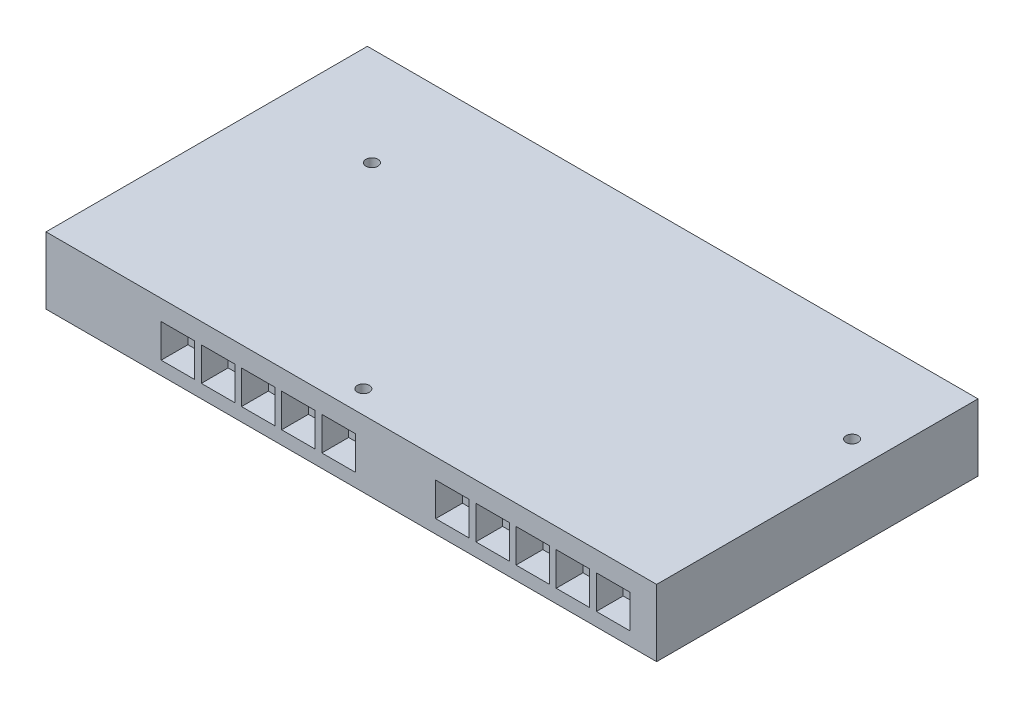
from build123d import *

# Parameters (mm, degrees)
SKETCH1_W                              = 228
SKETCH1_H                              = 25
BOSS_EXTRUDE1_DEPTH                    = 60
SKETCH3_W                              = 12.5
SKETCH3_H                              = 12.5
CUT_EXTRUDE2_DEPTH                     = 10
LPATTERN1_COUNT                        = 2
LPATTERN1_PITCH                        = 102.5
SKETCH7_R                              = 7.5
BOSS_EXTRUDE4_DEPTH                    = 3
BOSS_EXTRUDE4_DRAFT                    = 20
BOSS_EXTRUDE4_PROFILE_2_DEPTH          = 3
BOSS_EXTRUDE4_PROFILE_2_DRAFT          = 20
BOSS_EXTRUDE4_PROFILE_3_DEPTH          = 3
BOSS_EXTRUDE4_PROFILE_3_DRAFT          = 20
BOSS_EXTRUDE4_PROFILE_4_DEPTH          = 3
BOSS_EXTRUDE4_PROFILE_4_DRAFT          = 20
M3X0_5_TAPPED_HOLE1_D                  = 2.5
M3X0_5_TAPPED_HOLE1_DEPTH              = 5
M3X0_5_TAPPED_HOLE1_TIP                = 0.751075774
SKETCH12_W                             = 35
SKETCH12_H                             = 25
CUT_EXTRUDE3_DEPTH                     = 15
SKETCH6_R                              = 7
CUT_EXTRUDE4_DEPTH                     = 10
F_4_5_4_5_DRILL_BIT_FOR_PEM_NUTS_D     = 4.5
F_4_5_4_5_DRILL_BIT_FOR_PEM_NUTS_DEPTH = 5
F_4_5_4_5_DRILL_BIT_FOR_PEM_NUTS_TIP   = 1.351936393


with BuildPart() as part:
    # Sketch1 → Boss-Extrude1 (new, symmetric)
    with BuildSketch(Plane.XY):
        Rectangle(SKETCH1_W, SKETCH1_H)
    extrude(amount=BOSS_EXTRUDE1_DEPTH, both=True)

    # Sketch3 → Cut-Extrude2 (cut)
    with BuildSketch(Plane.XY.offset(60)):
        with Locations((82.75, -1.25)):
            Rectangle(SKETCH3_W, SKETCH3_H)
        with Locations((97.75, -1.25)):
            Rectangle(SKETCH3_W, SKETCH3_H)
        with Locations((67.75, -1.25)):
            Rectangle(SKETCH3_W, SKETCH3_H)
        with Locations((52.75, -1.25)):
            Rectangle(SKETCH3_W, SKETCH3_H)
        with Locations((37.75, -1.25)):
            Rectangle(SKETCH3_W, SKETCH3_H)
    cut_extrude2 = extrude(amount=-CUT_EXTRUDE2_DEPTH, mode=Mode.SUBTRACT)

    # LPattern1: Cut-Extrude2 ×2
    with Locations(*[(-i * LPATTERN1_PITCH, 0, 0) for i in range(1, LPATTERN1_COUNT)]):
        add(cut_extrude2, mode=Mode.SUBTRACT)


with BuildPart() as boss_extrude4_tool:
    # Sketch7 → Boss-Extrude4 (with draft: the straight prism first)
    with BuildSketch(Plane.XZ.offset(12.5)):
        with Locations((-84, -25)):
            Circle(SKETCH7_R)
    extrude(amount=BOSS_EXTRUDE4_DEPTH)
    # Boss-Extrude4: the draft: its side faces are tilted about the plane it starts from
    boss_extrude4_sides = [boss_extrude4_tool.faces().sort_by_distance(p)[0] for p in [
        (-91.5, -14, -25),
    ]]
    draft(boss_extrude4_sides, Plane.XZ.offset(12.5), BOSS_EXTRUDE4_DRAFT)


with BuildPart() as part_1:
    add(part.part)

    # Boss-Extrude4: add boss_extrude4_tool
    add(boss_extrude4_tool.part)


with BuildPart() as boss_extrude4_profile_2_tool:
    # Sketch7 → Boss-Extrude4 profile 2 (with draft: the straight prism first)
    with BuildSketch(Plane.XZ.offset(12.5)):
        with Locations((-84, 40)):
            Circle(SKETCH7_R)
    extrude(amount=BOSS_EXTRUDE4_PROFILE_2_DEPTH)
    # Boss-Extrude4 profile 2: the draft: its side faces are tilted about the plane it starts from
    boss_extrude4_profile_2_sides = [boss_extrude4_profile_2_tool.faces().sort_by_distance(p)[0] for p in [
        (-91.5, -14, 40),
    ]]
    draft(boss_extrude4_profile_2_sides, Plane.XZ.offset(12.5), BOSS_EXTRUDE4_PROFILE_2_DRAFT)


with BuildPart() as part_2:
    add(part_1.part)

    # Boss-Extrude4 profile 2: add boss_extrude4_profile_2_tool
    add(boss_extrude4_profile_2_tool.part)


with BuildPart() as boss_extrude4_profile_3_tool:
    # Sketch7 → Boss-Extrude4 profile 3 (with draft: the straight prism first)
    with BuildSketch(Plane.XZ.offset(12.5)):
        with Locations((84, 40)):
            Circle(SKETCH7_R)
    extrude(amount=BOSS_EXTRUDE4_PROFILE_3_DEPTH)
    # Boss-Extrude4 profile 3: the draft: its side faces are tilted about the plane it starts from
    boss_extrude4_profile_3_sides = [boss_extrude4_profile_3_tool.faces().sort_by_distance(p)[0] for p in [
        (76.5, -14, 40),
    ]]
    draft(boss_extrude4_profile_3_sides, Plane.XZ.offset(12.5), BOSS_EXTRUDE4_PROFILE_3_DRAFT)


with BuildPart() as part_3:
    add(part_2.part)

    # Boss-Extrude4 profile 3: add boss_extrude4_profile_3_tool
    add(boss_extrude4_profile_3_tool.part)


with BuildPart() as boss_extrude4_profile_4_tool:
    # Sketch7 → Boss-Extrude4 profile 4 (with draft: the straight prism first)
    with BuildSketch(Plane.XZ.offset(12.5)):
        with Locations((84, -25)):
            Circle(SKETCH7_R)
    extrude(amount=BOSS_EXTRUDE4_PROFILE_4_DEPTH)
    # Boss-Extrude4 profile 4: the draft: its side faces are tilted about the plane it starts from
    boss_extrude4_profile_4_sides = [boss_extrude4_profile_4_tool.faces().sort_by_distance(p)[0] for p in [
        (76.5, -14, -25),
    ]]
    draft(boss_extrude4_profile_4_sides, Plane.XZ.offset(12.5), BOSS_EXTRUDE4_PROFILE_4_DRAFT)


with BuildPart() as part_4:
    add(part_3.part)

    # Boss-Extrude4 profile 4: add boss_extrude4_profile_4_tool
    add(boss_extrude4_profile_4_tool.part)

    # M3x0.5 Tapped Hole1
    with Locations(Plane(origin=(0, -12.5, 0), x_dir=(-1, 0, 0), z_dir=(0, -1, 0))):
        with Locations((105.75, -25), (-105.75, -25)):
            Hole(M3X0_5_TAPPED_HOLE1_D / 2, depth=M3X0_5_TAPPED_HOLE1_DEPTH)
            with Locations((0, 0, -(M3X0_5_TAPPED_HOLE1_DEPTH + M3X0_5_TAPPED_HOLE1_TIP / 2))):  # 118° drill point
                Cone(0, M3X0_5_TAPPED_HOLE1_D / 2, M3X0_5_TAPPED_HOLE1_TIP, mode=Mode.SUBTRACT)

    # Sketch12 → Cut-Extrude3 (cut)
    with BuildSketch(Plane.XZ.offset(12.5)):
        with Locations((-76.5, -47.5)):
            Rectangle(SKETCH12_W, SKETCH12_H)
    extrude(amount=-CUT_EXTRUDE3_DEPTH, mode=Mode.SUBTRACT)

    # Sketch6 → Cut-Extrude4 (cut)
    with BuildSketch(Plane(origin=(0, 0, -60), x_dir=(-1, 0, 0), z_dir=(0, 0, -1))):
        with Locations((-103, 0)):
            Circle(SKETCH6_R)
        with Locations((-29, 0)):
            Circle(SKETCH6_R)
        with Locations((29, 0)):
            Circle(SKETCH6_R)
        with Locations((103, 0)):
            Circle(SKETCH6_R)
    extrude(amount=-CUT_EXTRUDE4_DEPTH, mode=Mode.SUBTRACT)

    # Ø4.5 (4.5) Drill Bit for PEM Nuts
    with Locations(Plane(origin=(0, 12.5, 0), x_dir=(1, 0, 0), z_dir=(0, 1, 0))):
        with Locations((-4, -51.5), (-75.5, 23.2), (103.5, 23.5)):
            Hole(F_4_5_4_5_DRILL_BIT_FOR_PEM_NUTS_D / 2, depth=F_4_5_4_5_DRILL_BIT_FOR_PEM_NUTS_DEPTH)
            with Locations((0, 0, -(F_4_5_4_5_DRILL_BIT_FOR_PEM_NUTS_DEPTH + F_4_5_4_5_DRILL_BIT_FOR_PEM_NUTS_TIP / 2))):  # 118° drill point
                Cone(0, F_4_5_4_5_DRILL_BIT_FOR_PEM_NUTS_D / 2, F_4_5_4_5_DRILL_BIT_FOR_PEM_NUTS_TIP, mode=Mode.SUBTRACT)


solid = part_4.part
